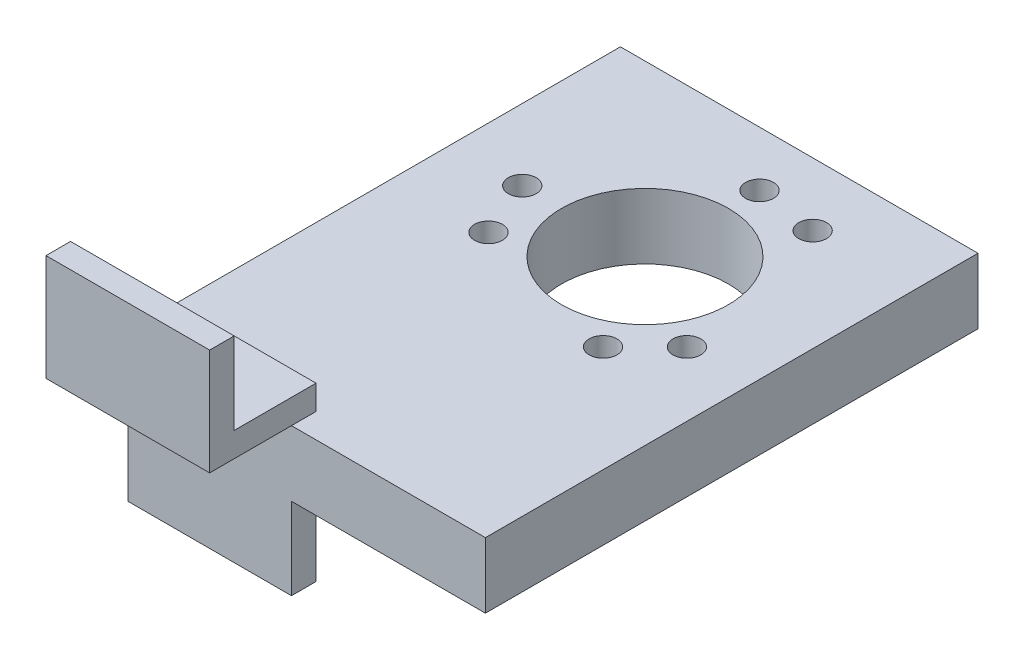
from build123d import *

# Parameters (mm, degrees)
SKETCH1_W           = 43.7
SKETCH1_H           = 60.2
SKETCH1_R           = 1.7
SKETCH1_R_2         = 10.2
BOSS_EXTRUDE2_DEPTH = 8
SKETCH2_W           = 20
SKETCH2_H           = 3
BOSS_EXTRUDE3_DEPTH = 10
SKETCH3_W           = 20
SKETCH3_H           = 3
BOSS_EXTRUDE4_DEPTH = 3
SKETCH5_W           = 20
SKETCH5_H           = 3
BOSS_EXTRUDE5_DEPTH = 10
SKETCH6_W           = 20
SKETCH6_H           = 3
BOSS_EXTRUDE6_DEPTH = 10


with BuildPart() as part:
    # Sketch1 → Boss-Extrude2 (new body)
    with BuildSketch(Plane(origin=(0, 0, 0), x_dir=(1, 0, 0), z_dir=(0, 1, 0))):
        with Locations((-1.85, 30.1)):
            Rectangle(SKETCH1_W, SKETCH1_H)
        with Locations(Location((7, 27.375644347, 0), (0, 0, 270))):
            Circle(SKETCH1_R, mode=Mode.SUBTRACT)
        with Locations(Location((7.5, 52.490381057, 0), (0, 0, 270))):
            Circle(SKETCH1_R, mode=Mode.SUBTRACT)
        with Locations(Location((0, 53.5, 0), (0, 0, 270))):
            Circle(SKETCH1_R, mode=Mode.SUBTRACT)
        with Locations(Location((-15, 39.5, 0), (0, 0, 270))):
            Circle(SKETCH1_R, mode=Mode.SUBTRACT)
        with Locations(Location((12.124355653, 32.5, 0), (0, 0, 270))):
            Circle(SKETCH1_R, mode=Mode.SUBTRACT)
        with Locations(Location((0, 39.5, 0), (0, 0, 270))):
            Circle(SKETCH1_R_2, mode=Mode.SUBTRACT)
        with Locations(Location((-12.124355653, 32.5, 0), (0, 0, 270))):
            Circle(SKETCH1_R, mode=Mode.SUBTRACT)
    extrude(amount=BOSS_EXTRUDE2_DEPTH)

    # Sketch2 → Boss-Extrude3 (add)
    with BuildSketch(Plane.XZ):
        with Locations((-13.7, -1.5)):
            Rectangle(SKETCH2_W, SKETCH2_H)
    extrude(amount=BOSS_EXTRUDE3_DEPTH)

    # Sketch3 → Boss-Extrude4 (add)
    with BuildSketch(Plane(origin=(0, 8, 0), x_dir=(1, 0, 0), z_dir=(0, 1, 0))):
        with Locations((-13.7, 1.5)):
            Rectangle(SKETCH3_W, SKETCH3_H)
    extrude(amount=BOSS_EXTRUDE4_DEPTH)

    # Sketch5 → Boss-Extrude5 (add)
    with BuildSketch(Plane.XY):
        with Locations((-13.7, 9.5)):
            Rectangle(SKETCH5_W, SKETCH5_H)
    extrude(amount=BOSS_EXTRUDE5_DEPTH)

    # Sketch6 → Boss-Extrude6 (add)
    with BuildSketch(Plane(origin=(0, 11, 0), x_dir=(1, 0, 0), z_dir=(0, 1, 0))):
        with Locations((-13.7, -8.5)):
            Rectangle(SKETCH6_W, SKETCH6_H)
    extrude(amount=BOSS_EXTRUDE6_DEPTH)


solid = part.part
